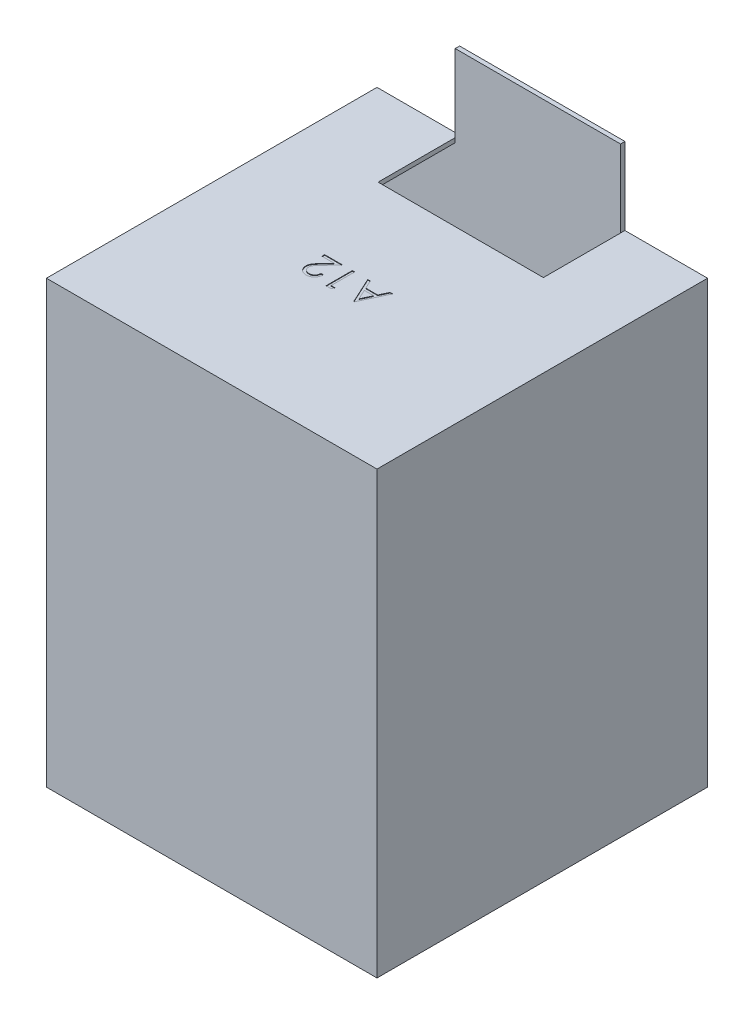
from build123d import *

# Parameters (mm, degrees)
ESQUISSE1_W             = 300
ESQUISSE1_H             = 400
BOSS_EXTRU_1_DEPTH      = 300
ESQUISSE2_W             = 292
ESQUISSE2_H             = 392
ENL_V_MAT_EXTRU_1_DEPTH = 296
ESQUISSE3_W             = 300
ESQUISSE3_H             = 400
BOSS_EXTRU_2_DEPTH      = 4
ESQUISSE4_W             = 150
ESQUISSE4_H             = 70
ENL_V_MAT_EXTRU_2_DEPTH = 4
ESQUISSE5_W             = 150
ESQUISSE5_H             = 70
ENL_V_MAT_EXTRU_3_DEPTH = 4
ESQUISSE6_W             = 150
ESQUISSE6_H             = 4
BOSS_EXTRU_3_DEPTH      = 70
ESQUISSE7_W             = 150
ESQUISSE7_H             = 4
BOSS_EXTRU_4_DEPTH      = 70
ENL_V_MAT_EXTRU_4_DEPTH = 0.5
ENL_V_MAT_EXTRU_5_DEPTH = 0.5


with BuildPart() as part:
    # Esquisse1 → Boss.-Extru.1 (new body)
    with BuildSketch(Plane.XY):
        with Locations((150, -200)):
            Rectangle(ESQUISSE1_W, ESQUISSE1_H)
    extrude(amount=BOSS_EXTRU_1_DEPTH)

    # Esquisse2 → Enlèv. mat.-Extru.1 (cut)
    with BuildSketch(Plane.XY.offset(300)):
        with Locations((150, -200)):
            Rectangle(ESQUISSE2_W, ESQUISSE2_H)
    extrude(amount=-ENL_V_MAT_EXTRU_1_DEPTH, mode=Mode.SUBTRACT)

    # Esquisse3 → Boss.-Extru.2 (add)
    with BuildSketch(Plane.XY.offset(300)):
        with Locations((150, -200)):
            Rectangle(ESQUISSE3_W, ESQUISSE3_H)
    extrude(amount=-BOSS_EXTRU_2_DEPTH)

    # Esquisse4 → Enlèv. mat.-Extru.2 (cut)
    with BuildSketch(Plane(origin=(0, -400, 0), x_dir=(-1, 0, 0), z_dir=(0, -1, 0))):
        with Locations((-150, -39)):
            Rectangle(ESQUISSE4_W, ESQUISSE4_H)
    extrude(amount=-ENL_V_MAT_EXTRU_2_DEPTH, mode=Mode.SUBTRACT)

    # Esquisse5 → Enlèv. mat.-Extru.3 (cut)
    with BuildSketch(Plane.XZ.offset(4)):
        with Locations((150, 39)):
            Rectangle(ESQUISSE5_W, ESQUISSE5_H)
    extrude(amount=-ENL_V_MAT_EXTRU_3_DEPTH, mode=Mode.SUBTRACT)

    # Esquisse6 → Boss.-Extru.3 (add)
    with BuildSketch(Plane(origin=(0, -400, 0), x_dir=(-1, 0, 0), z_dir=(0, -1, 0))):
        with Locations((-150, -2)):
            Rectangle(ESQUISSE6_W, ESQUISSE6_H)
    extrude(amount=BOSS_EXTRU_3_DEPTH)

    # Esquisse7 → Boss.-Extru.4 (add)
    with BuildSketch(Plane(origin=(0, 0, 0), x_dir=(1, 0, 0), z_dir=(0, 1, 0))):
        with Locations((150, -2)):
            Rectangle(ESQUISSE7_W, ESQUISSE7_H)
    extrude(amount=BOSS_EXTRU_4_DEPTH)

    # Esquisse9 → Enlèv. mat.-Extru.4 (cut)
    # profile 1 of 3: a face of its own
    with BuildSketch(Plane(origin=(0, 0, 0), x_dir=(1, 0, 0), z_dir=(0, 1, 0))):
        with BuildLine():
            Line((120.898075082, -171.725213166), (123.035094313, -171.725213166))
            add(Edge.make_bspline(
                [(123.035094313, -171.725213166), (123.021168732, -172.008725424), (122.993819261, -172.565535956), (122.865686105, -173.377344901), (122.682513331, -174.153396441), (122.422914778, -174.88703736), (122.10233325, -175.587031613), (121.709848687, -176.244084087), (121.253828225, -176.86471595), (120.73510845, -177.437176583), (120.172249688, -177.960477176), (119.568624336, -178.417156122), (118.930436523, -178.798590539), (118.263221617, -179.119194964), (117.559263081, -179.359555314), (116.825289969, -179.537977084), (116.057984799, -179.645306859), (115.535198808, -179.656845047), (115.269319072, -179.662713166)],
                knots=[0, 0, 0, 0, 1.100776268, 2.161895295, 3.184016182, 4.190939212, 5.176500551, 6.166955529, 7.155448256, 8.160289653, 9.16017456, 10.133824356, 11.091467644, 12.04088621, 13.000931625, 13.972173743, 14.968683325, 16, 16, 16, 16], degree=3))
            add(Edge.make_bspline(
                [(115.269319072, -179.662713166), (115.008192729, -179.656650058), (114.495088792, -179.644736268), (113.74653396, -179.540885382), (113.032233125, -179.381743154), (112.360281451, -179.145919443), (111.723782825, -178.85001227), (111.130618157, -178.482012933), (110.566444106, -178.05933392), (110.058949353, -177.560763298), (109.592754199, -177.028787185), (109.190922162, -176.460641169), (108.844861251, -175.873160695), (108.561621204, -175.261756685), (108.346912653, -174.624438111), (108.187834194, -173.967315164), (108.09689635, -173.282804199), (108.083016372, -172.819423055), (108.075959697, -172.583836964)],
                knots=[0, 0, 0, 0, 1.111674182, 2.184400057, 3.212814286, 4.223731311, 5.211378316, 6.196328225, 7.191884489, 8.207283132, 9.220262353, 10.201199469, 11.166417575, 12.120932471, 13.06540007, 14.026332106, 14.996573967, 16, 16, 16, 16], degree=3))
            add(Edge.make_bspline(
                [(108.075959697, -172.583836964), (108.087480113, -172.252177732), (108.110318778, -171.594679418), (108.305676436, -170.628469063), (108.610802978, -169.692350374), (108.978145295, -168.938915551), (109.348825329, -168.331866577), (109.682527761, -167.831805671), (110.075403335, -167.293516206), (110.524095495, -166.714819463), (111.036331357, -166.103293963), (111.598803103, -165.446462944), (112.226036758, -164.756471664), (112.665878342, -164.284891302), (112.893793231, -164.040530173)],
                knots=[0, 0, 0, 0, 1.184416499, 2.348048165, 3.509039915, 4.696071444, 5.333504901, 6.05069495, 6.844171097, 7.714965912, 8.667477798, 9.695072654, 10.805644396, 12, 12, 12, 12], degree=3))
            Line((112.893793231, -164.040530173), (118.851688363, -157.681943935))
            Line((118.851688363, -157.681943935), (107.770671236, -157.681943935))
            Line((107.770671236, -157.681943935), (107.770671236, -155.239636242))
            Line((107.770671236, -155.239636242), (123.950959697, -155.239636242))
            Line((123.950959697, -155.239636242), (114.715983736, -165.094729392))
            add(Edge.make_bspline(
                [(114.715983736, -165.094729392), (114.491124159, -165.329428283), (114.05921493, -165.78023682), (113.44858219, -166.438602884), (112.899253603, -167.048661008), (112.410864777, -167.613114506), (111.98301386, -168.128763453), (111.617069788, -168.59964887), (111.311415155, -169.021729754), (110.987484938, -169.517572727), (110.678595981, -170.123686103), (110.407114194, -170.86066253), (110.242762813, -171.620999691), (110.222946635, -172.134657429), (110.212978928, -172.393031675)],
                knots=[0, 0, 0, 0, 1.329530082, 2.553755191, 3.672934919, 4.687409497, 5.60679272, 6.413407421, 7.126401618, 7.737995624, 8.834647426, 9.90044882, 10.943907757, 12, 12, 12, 12], degree=3))
            add(Edge.make_bspline(
                [(110.212978928, -172.393031675), (110.217259817, -172.55552843), (110.225696626, -172.875778329), (110.301565945, -173.345006322), (110.413033033, -173.799386451), (110.584838249, -174.233300629), (110.79125589, -174.655283111), (111.054969648, -175.052504312), (111.356325223, -175.438504551), (111.705882908, -175.800048198), (112.089632295, -176.131278321), (112.495099197, -176.424669831), (112.924061648, -176.669866136), (113.374731972, -176.87086699), (113.845848219, -177.028542471), (114.33832307, -177.13779813), (114.850795377, -177.206395039), (115.200726841, -177.215676279), (115.379032113, -177.220405473)],
                knots=[0, 0, 0, 0, 0.991504627, 1.954065223, 2.895985987, 3.842598665, 4.797835564, 5.759220273, 6.74786863, 7.784730864, 8.824135544, 9.839918996, 10.835834653, 11.835434876, 12.84861661, 13.863796685, 14.911511676, 16, 16, 16, 16], degree=3))
            add(Edge.make_bspline(
                [(115.379032113, -177.220405473), (115.565299097, -177.215734132), (115.931096697, -177.20656039), (116.467014458, -177.13703101), (116.981840847, -177.03173231), (117.467642534, -176.86409764), (117.934586484, -176.667903161), (118.370760723, -176.41386582), (118.788417931, -176.123588873), (119.179160983, -175.785144389), (119.535043467, -175.403091545), (119.858792948, -174.987233776), (120.133109094, -174.530198765), (120.376616768, -174.042953201), (120.562852064, -173.512110436), (120.722069897, -172.950652877), (120.83772342, -172.350569845), (120.877623735, -171.937127572), (120.898075082, -171.725213166)],
                knots=[0, 0, 0, 0, 1.031072318, 2.024855787, 2.988461151, 3.935103592, 4.865765533, 5.788564469, 6.724086513, 7.67908574, 8.64457978, 9.611397706, 10.591395687, 11.591555111, 12.622101007, 13.700900657, 14.821571223, 16, 16, 16, 16], degree=3))
        make_face()
    # profile 2 of 3: a face of its own
    with BuildSketch(Plane(origin=(0, 0, 0), x_dir=(1, 0, 0), z_dir=(0, 1, 0))):
        Polygon((137.207157113, -179.052136242), (132.804325082, -179.052136242), (132.804325082, -155.239636242), (134.941344313, -155.239636242), (134.941344313, -176.60982855), (138.604805851, -176.60982855), align=None)
    # profile 3 of 3: a face of its own
    with BuildSketch(Plane(origin=(0, 0, 0), x_dir=(1, 0, 0), z_dir=(0, 1, 0))):
        Polygon((157.837978928, -179.052136242), (146.847594313, -155.239636242), (149.1706487, -155.239636242), (152.691006272, -162.871847781), (163.485815467, -162.871847781), (167.106345815, -155.239636242), (169.438940467, -155.239636242), (158.14326739, -179.052136242), align=None)
        Polygon((158.01447382, -174.410797601), (162.326673339, -165.314155473), (153.816757474, -165.314155473), align=None, mode=Mode.SUBTRACT)
    extrude(amount=-ENL_V_MAT_EXTRU_4_DEPTH, mode=Mode.SUBTRACT)

    # Esquisse10 → Enlèv. mat.-Extru.5 (cut)
    # profile 1 of 3: a face of its own
    with BuildSketch(Plane(origin=(0, -400, 0), x_dir=(-1, 0, 0), z_dir=(0, -1, 0))):
        with BuildLine():
            Line((-162.399724917, -166.457085247), (-160.262705686, -166.457085247))
            add(Edge.make_bspline(
                [(-160.262705686, -166.457085247), (-160.276631267, -166.740597506), (-160.303980738, -167.297408038), (-160.432113894, -168.109216983), (-160.615286668, -168.885268523), (-160.874885221, -169.618909441), (-161.195466749, -170.318903695), (-161.587951312, -170.975956169), (-162.043971774, -171.596588032), (-162.562691549, -172.169048665), (-163.125550311, -172.692349257), (-163.729175663, -173.149028203), (-164.367363476, -173.530462621), (-165.034578382, -173.851067045), (-165.738536918, -174.091427395), (-166.47251003, -174.269849166), (-167.2398152, -174.37717894), (-167.762601191, -174.388717128), (-168.028480927, -174.394585247)],
                knots=[0, 0, 0, 0, 1.100776268, 2.161895295, 3.184016182, 4.190939212, 5.176500551, 6.166955529, 7.155448256, 8.160289653, 9.16017456, 10.133824356, 11.091467644, 12.04088621, 13.000931625, 13.972173743, 14.968683325, 16, 16, 16, 16], degree=3))
            add(Edge.make_bspline(
                [(-168.028480927, -174.394585247), (-168.28960727, -174.38852214), (-168.802711207, -174.37660835), (-169.551266039, -174.272757463), (-170.265566874, -174.113615236), (-170.937518548, -173.877791525), (-171.574017174, -173.581884352), (-172.167181842, -173.213885014), (-172.731355893, -172.791206002), (-173.238850646, -172.29263538), (-173.7050458, -171.760659267), (-174.106877837, -171.192513251), (-174.452938748, -170.605032776), (-174.736178795, -169.993628767), (-174.950887346, -169.356310193), (-175.109965805, -168.699187245), (-175.200903649, -168.014676281), (-175.214783627, -167.551295136), (-175.221840302, -167.315709045)],
                knots=[0, 0, 0, 0, 1.111674182, 2.184400057, 3.212814286, 4.223731311, 5.211378316, 6.196328225, 7.191884489, 8.207283132, 9.220262353, 10.201199469, 11.166417575, 12.120932471, 13.06540007, 14.026332106, 14.996573967, 16, 16, 16, 16], degree=3))
            add(Edge.make_bspline(
                [(-175.221840302, -167.315709045), (-175.210319886, -166.984049814), (-175.187481221, -166.3265515), (-174.992123563, -165.360341144), (-174.686997021, -164.424222456), (-174.319654704, -163.670787633), (-173.94897467, -163.063738659), (-173.615272238, -162.563677752), (-173.222396664, -162.025388288), (-172.773704504, -161.446691544), (-172.261468642, -160.835166045), (-171.698996896, -160.178335026), (-171.071763241, -159.488343746), (-170.631921657, -159.016763384), (-170.404006768, -158.772402255)],
                knots=[0, 0, 0, 0, 1.184416499, 2.348048165, 3.509039915, 4.696071444, 5.333504901, 6.05069495, 6.844171097, 7.714965912, 8.667477798, 9.695072654, 10.805644396, 12, 12, 12, 12], degree=3))
            Line((-170.404006768, -158.772402255), (-164.446111636, -152.413816017))
            Line((-164.446111636, -152.413816017), (-175.527128763, -152.413816017))
            Line((-175.527128763, -152.413816017), (-175.527128763, -149.971508324))
            Line((-175.527128763, -149.971508324), (-159.346840302, -149.971508324))
            Line((-159.346840302, -149.971508324), (-168.581816263, -159.826601473))
            add(Edge.make_bspline(
                [(-168.581816263, -159.826601473), (-168.80667584, -160.061300364), (-169.238585069, -160.512108902), (-169.849217809, -161.170474966), (-170.398546396, -161.78053309), (-170.886935222, -162.344986588), (-171.314786139, -162.860635535), (-171.680730211, -163.331520951), (-171.986384844, -163.753601835), (-172.310315061, -164.249444809), (-172.619204018, -164.855558185), (-172.890685805, -165.592534612), (-173.055037186, -166.352871773), (-173.074853364, -166.866529511), (-173.084821071, -167.124903757)],
                knots=[0, 0, 0, 0, 1.329530082, 2.553755191, 3.672934919, 4.687409497, 5.60679272, 6.413407421, 7.126401618, 7.737995624, 8.834647426, 9.90044882, 10.943907757, 12, 12, 12, 12], degree=3))
            add(Edge.make_bspline(
                [(-173.084821071, -167.124903757), (-173.080540182, -167.287400512), (-173.072103373, -167.607650411), (-172.996234054, -168.076878404), (-172.884766966, -168.531258532), (-172.71296175, -168.965172711), (-172.506544109, -169.387155193), (-172.242830351, -169.784376394), (-171.941474776, -170.170376632), (-171.591917091, -170.53192028), (-171.208167704, -170.863150402), (-170.802700802, -171.156541913), (-170.373738351, -171.401738218), (-169.923068027, -171.602739072), (-169.45195178, -171.760414552), (-168.959476929, -171.869670212), (-168.447004622, -171.938267121), (-168.097073158, -171.94754836), (-167.918767886, -171.952277555)],
                knots=[0, 0, 0, 0, 0.991504627, 1.954065223, 2.895985987, 3.842598665, 4.797835564, 5.759220273, 6.74786863, 7.784730864, 8.824135544, 9.839918996, 10.835834653, 11.835434876, 12.84861661, 13.863796685, 14.911511676, 16, 16, 16, 16], degree=3))
            add(Edge.make_bspline(
                [(-167.918767886, -171.952277555), (-167.732500902, -171.947606214), (-167.366703302, -171.938432472), (-166.830785541, -171.868903092), (-166.315959152, -171.763604391), (-165.830157465, -171.595969722), (-165.363213515, -171.399775242), (-164.927039276, -171.145737902), (-164.509382068, -170.855460955), (-164.118639016, -170.517016471), (-163.762756532, -170.134963627), (-163.439007051, -169.719105857), (-163.164690905, -169.262070847), (-162.921183231, -168.774825283), (-162.734947935, -168.243982517), (-162.575730102, -167.682524958), (-162.460076579, -167.082441927), (-162.420176264, -166.668999654), (-162.399724917, -166.457085247)],
                knots=[0, 0, 0, 0, 1.031072318, 2.024855787, 2.988461151, 3.935103592, 4.865765533, 5.788564469, 6.724086513, 7.67908574, 8.64457978, 9.611397706, 10.591395687, 11.591555111, 12.622101007, 13.700900657, 14.821571223, 16, 16, 16, 16], degree=3))
        make_face()
    # profile 2 of 3: a face of its own
    with BuildSketch(Plane(origin=(0, -400, 0), x_dir=(-1, 0, 0), z_dir=(0, -1, 0))):
        Polygon((-146.090642886, -173.784008324), (-150.493474917, -173.784008324), (-150.493474917, -149.971508324), (-148.356455686, -149.971508324), (-148.356455686, -171.341700632), (-144.692994148, -171.341700632), align=None)
    # profile 3 of 3: a face of its own
    with BuildSketch(Plane(origin=(0, -400, 0), x_dir=(-1, 0, 0), z_dir=(0, -1, 0))):
        Polygon((-125.459821071, -173.784008324), (-136.450205686, -149.971508324), (-134.127151299, -149.971508324), (-130.606793727, -157.603719863), (-119.811984532, -157.603719863), (-116.191454184, -149.971508324), (-113.858859532, -149.971508324), (-125.154532609, -173.784008324), align=None)
        Polygon((-125.283326179, -169.142669682), (-120.97112666, -160.046027555), (-129.481042525, -160.046027555), align=None, mode=Mode.SUBTRACT)
    extrude(amount=-ENL_V_MAT_EXTRU_5_DEPTH, mode=Mode.SUBTRACT)


solid = part.part
